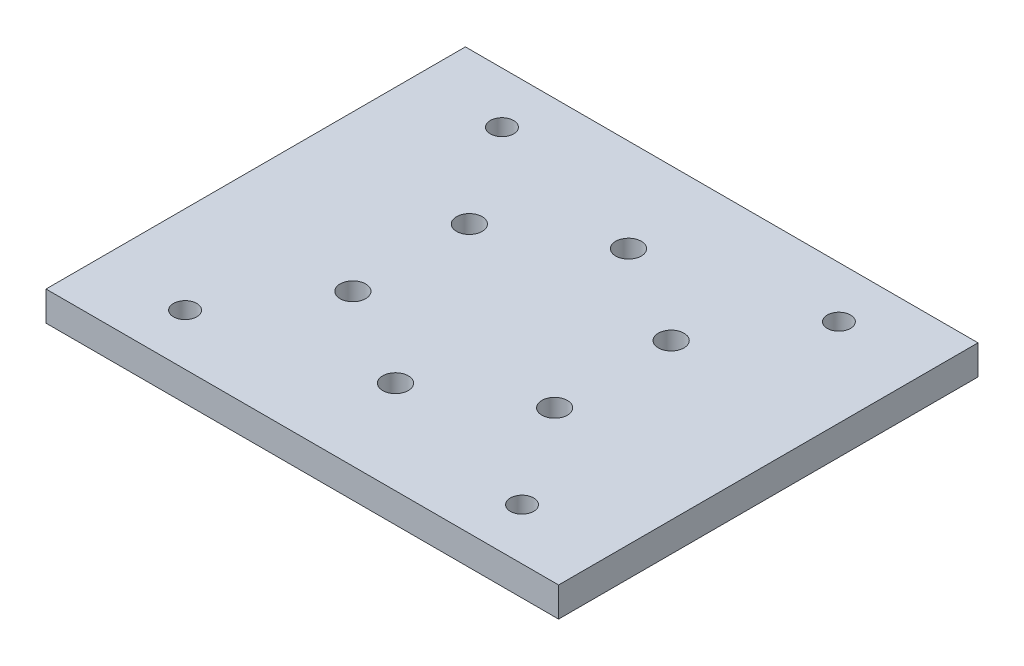
from build123d import *

# Parameters (mm, degrees)
SKETCH2_W            = 110
SKETCH2_H            = 90
BOSS_EXTRUDE1_DEPTH  = 6.35
SKETCH3_R            = 2.5
MOUNTING_HOLES_DEPTH = 143.268487375
SKETCH4_R            = 2.75
CUT_EXTRUDE1_DEPTH   = 143.268487375


with BuildPart() as part:
    # Sketch2 → Boss-Extrude1 (new body)
    with BuildSketch(Plane(origin=(0, 0, 0), x_dir=(1, 0, 0), z_dir=(0, 1, 0))):
        with Locations((55, 45)):
            Rectangle(SKETCH2_W, SKETCH2_H)
    extrude(amount=BOSS_EXTRUDE1_DEPTH)

    # Sketch3 → Mounting Holes (cut, through all)
    with BuildSketch(Plane(origin=(0, 6.35, 0), x_dir=(1, 0, 0), z_dir=(0, 1, 0))):
        with Locations(Location((18.85, 79, 0), (0, 0, 270))):
            Circle(SKETCH3_R)
        with Locations(Location((18.85, 11, 0), (0, 0, 90))):
            Circle(SKETCH3_R)
        with Locations(Location((91.15, 11, 0), (0, 0, 270))):
            Circle(SKETCH3_R)
        with Locations(Location((91.15, 79, 0), (0, 0, 90))):
            Circle(SKETCH3_R)
    extrude(amount=-MOUNTING_HOLES_DEPTH, mode=Mode.SUBTRACT)

    # Sketch4 → Cut-Extrude1 (cut, through all)
    with BuildSketch(Plane(origin=(0, 6.35, 0), x_dir=(1, 0, 0), z_dir=(0, 1, 0))):
        with Locations(Location((55, 70, 0), (0, 0, 270))):
            Circle(SKETCH4_R)
        with Locations(Location((76.650635095, 57.5, 0), (0, 0, 270))):
            Circle(SKETCH4_R)
        with Locations(Location((76.650635095, 32.5, 0), (0, 0, 270))):
            Circle(SKETCH4_R)
        with Locations(Location((55, 20, 0), (0, 0, 270))):
            Circle(SKETCH4_R)
        with Locations(Location((33.349364905, 32.5, 0), (0, 0, 270))):
            Circle(SKETCH4_R)
        with Locations(Location((33.349364905, 57.5, 0), (0, 0, 270))):
            Circle(SKETCH4_R)
    extrude(amount=-CUT_EXTRUDE1_DEPTH, mode=Mode.SUBTRACT)


solid = part.part
